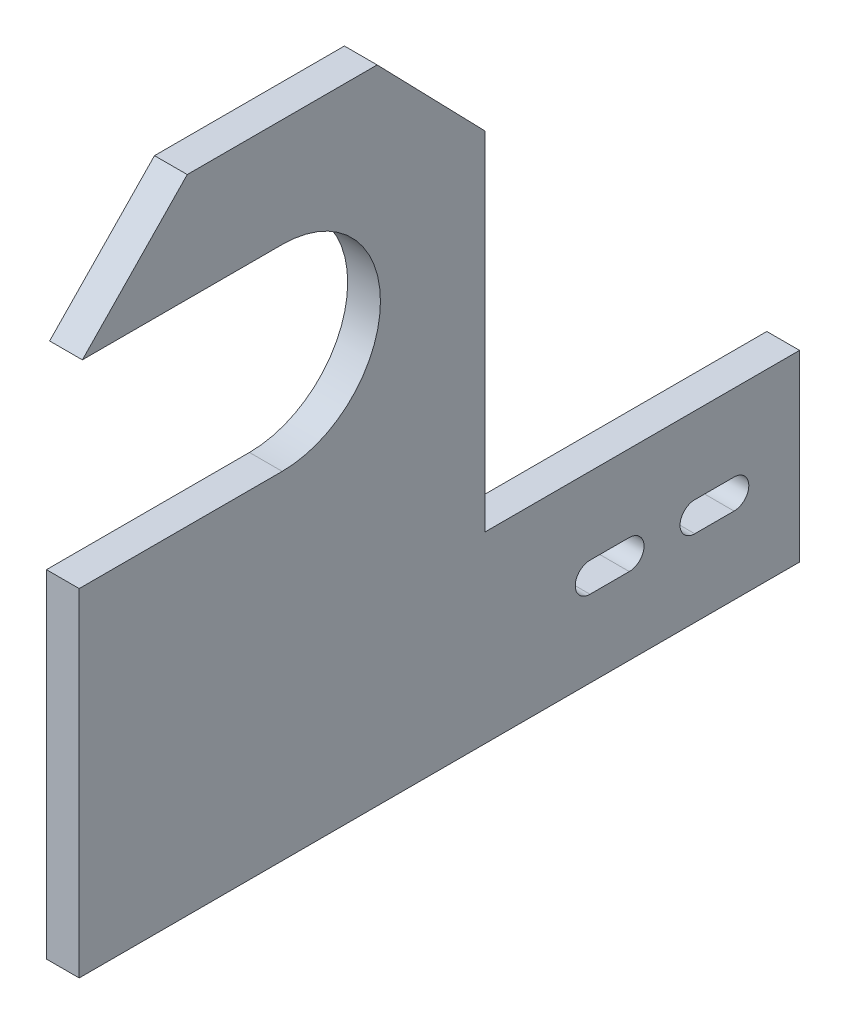
from build123d import *

# Parameters (mm, degrees)
RESSALTO_EXTRUS_O2_DEPTH = 5
RESSALTO_EXTRUS_O3_DEPTH = 5


with BuildPart() as part:
    # Esboço2 → Ressalto-extrusão2 (new body)
    with BuildSketch(Plane(origin=(0, 0, 0), x_dir=(0, 0, -1), z_dir=(1, 0, 0))):
        with BuildLine():
            Line((0.485294118, 49.5), (16.5, 66))
            Line((16.5, 66), (45.5, 66))
            Line((45.5, 66), (62, 49))
            Line((62, 49), (62, 0))
            Line((62, 0), (0, 0))
            Line((0, 0), (0, 19.5))
            Line((0, 19.5), (31, 19.5))
            ThreePointArc((31, 19.5), (46, 34.5), (31, 49.5))
            Line((31, 49.5), (0.485294118, 49.5))
        make_face()
    extrude(amount=-RESSALTO_EXTRUS_O2_DEPTH)

    # Esboço3 → Ressalto-extrusão3 (add)
    with BuildSketch(Plane(origin=(0, 0, 0), x_dir=(0, 0, -1), z_dir=(1, 0, 0))):
        Polygon((0, 0), (62, 0), (62, -4), (110, -4), (110, -32), (0, -32), align=None)
        with BuildLine():
            Line((78, -15.75), (84, -15.75))
            ThreePointArc((84, -15.75), (86.25, -18), (84, -20.25))
            Line((84, -20.25), (78, -20.25))
            ThreePointArc((78, -20.25), (75.75, -18), (78, -15.75))
        make_face(mode=Mode.SUBTRACT)
        with BuildLine():
            Line((94, -15.75), (100, -15.75))
            ThreePointArc((100, -15.75), (102.25, -18), (100, -20.25))
            Line((100, -20.25), (94, -20.25))
            ThreePointArc((94, -20.25), (91.75, -18), (94, -15.75))
        make_face(mode=Mode.SUBTRACT)
    extrude(amount=-RESSALTO_EXTRUS_O3_DEPTH)


solid = part.part
